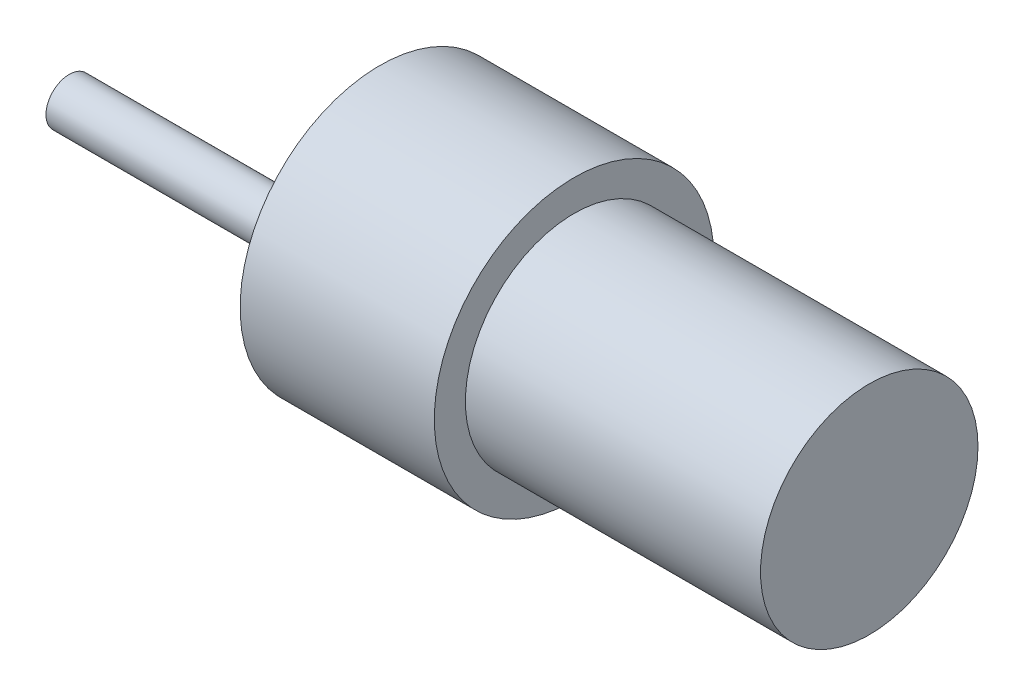
from build123d import *


with BuildPart() as part:
    # Sketch2 → Revolve2 (revolve)
    with BuildSketch(Plane.XY, mode=Mode.PRIVATE) as revolve2_sk:
        Polygon((46.393095281, 0), (46.393095281, 18), (71.393095281, 18), (71.393095281, 14), (109.393095281, 14), (109.393095281, 0), align=None)
    revolve(revolve2_sk.sketch.rotate(Axis((109.393095281, 0, 0), (-1, 0, 0)), 90), axis=Axis((109.393095281, 0, 0), (-1, 0, 0)))

    # Sketch13 → Revolve3 (revolve)
    with BuildSketch(Plane.XY, mode=Mode.PRIVATE) as revolve3_sk:
        Polygon((46.393095281, -6), (46.393095281, 0), (36.393095281, 0), (36.393095281, -3), (6.393095281, -3), (6.393095281, -6), align=None)
    revolve(revolve3_sk.sketch.rotate(Axis((46.393095281, -6, 0), (-1, 0, 0)), 90), axis=Axis((46.393095281, -6, 0), (-1, 0, 0)))


solid = part.part
